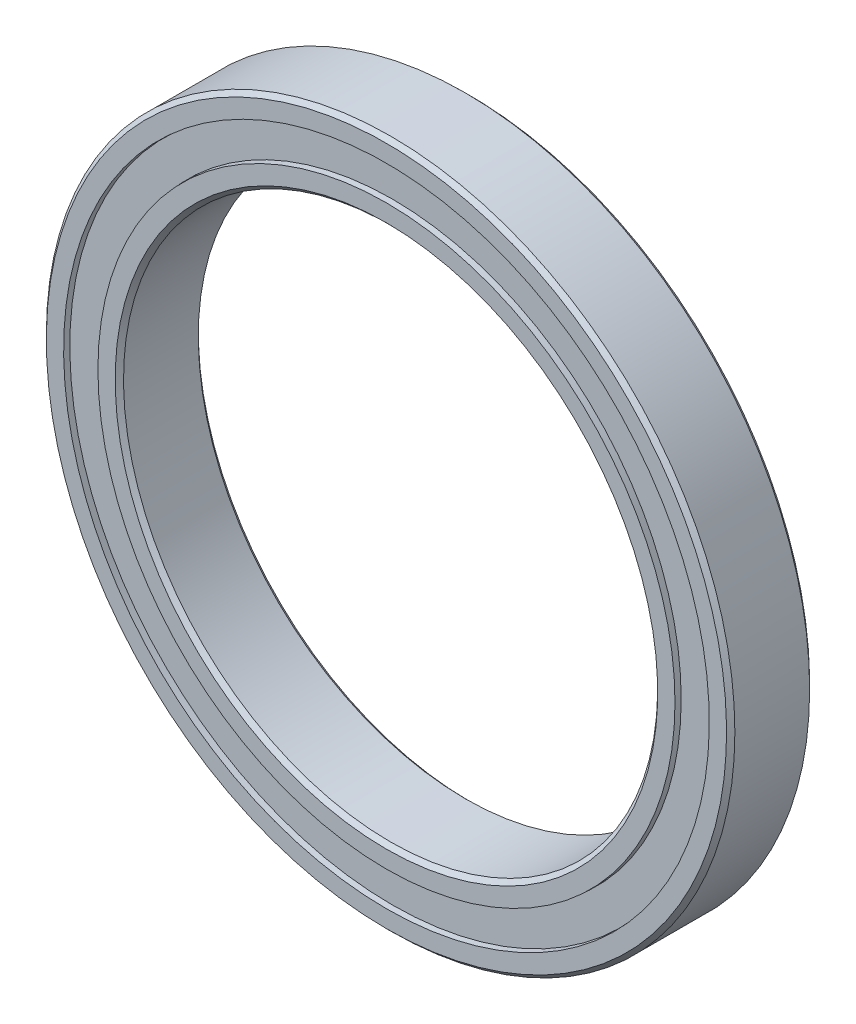
from build123d import *

# Parameters (mm, degrees)
SKETCH5_W         = 0.381
SKETCH5_H         = 2.838088888
CIRPATTERN1_COUNT = 21


with BuildPart() as part:
    # Sketch5 → Revolve1 (revolve)
    with BuildSketch(Plane(origin=(0, 0, 0), x_dir=(0, 0, -1), z_dir=(1, 0, 0)), mode=Mode.PRIVATE) as revolve1_sk:
        with BuildLine():
            Line((3.15, 29), (-3.15, 29))
            Line((-3.15, 29), (-3.5, 28.65))
            Line((-3.5, 28.65), (-3.5, 27.194444444))
            Line((-3.5, 27.194444444), (-1.555555556, 27.194444444))
            ThreePointArc((-1.555555556, 27.194444444), (0, 27.872774797), (1.555555556, 27.194444444))
            Line((1.555555556, 27.194444444), (3.5, 27.194444444))
            Line((3.5, 27.194444444), (3.5, 28.65))
            Line((3.5, 28.65), (3.15, 29))
        make_face()
        with Locations((2.811387399, 25.75)):
            Rectangle(SKETCH5_W, SKETCH5_H)
        with Locations((-2.811387399, 25.75)):
            Rectangle(SKETCH5_W, SKETCH5_H)
    revolve(revolve1_sk.sketch.rotate(Axis((0, 0, 3.5), (0, 0, -1)), 180), axis=Axis((0, 0, 3.5), (0, 0, -1)))


with BuildPart() as body_2:
    # Sketch3 → Revolve3 (revolve)
    with BuildSketch(Plane(origin=(0, 0, 0), x_dir=(0, 0, -1), z_dir=(1, 0, 0)), mode=Mode.PRIVATE) as revolve3_sk:
        with BuildLine():
            Line((-3.5, 24.305555556), (-1.555555556, 24.305555556))
            ThreePointArc((-1.555555556, 24.305555556), (0, 23.627225203), (1.555555556, 24.305555556))
            Line((1.555555556, 24.305555556), (3.5, 24.305555556))
            Line((3.5, 24.305555556), (3.5, 22.85))
            Line((3.5, 22.85), (3.15, 22.5))
            Line((3.15, 22.5), (-3.15, 22.5))
            Line((-3.15, 22.5), (-3.5, 22.85))
            Line((-3.5, 22.85), (-3.5, 24.305555556))
        make_face()
    revolve(revolve3_sk.sketch.rotate(Axis((0, 0, 3.5), (0, 0, -1)), 180), axis=Axis((0, 0, 3.5), (0, 0, -1)))


with BuildPart() as body_3:
    # Sketch4 → Revolve4 (revolve)
    with BuildSketch(Plane(origin=(0, 0, 0), x_dir=(0, 0, -1), z_dir=(1, 0, 0))):
        with BuildLine():
            Line((-2.122774797, 25.75), (2.122774797, 25.75))
            ThreePointArc((2.122774797, 25.75), (0, 27.872774797), (-2.122774797, 25.75))
        make_face()
    revolve(axis=Axis((0, 25.75, 2.122774797), (0, 0, -1)))


with BuildPart() as cirpattern1_1:
    # CirPattern1: pattern copy
    add(body_3.part.rotate(Axis((0, 0, 0), (0, 0, 1)), 1 * 360 / CIRPATTERN1_COUNT))


with BuildPart() as cirpattern1_2:
    # CirPattern1: pattern copy
    add(body_3.part.rotate(Axis((0, 0, 0), (0, 0, 1)), 2 * 360 / CIRPATTERN1_COUNT))


with BuildPart() as cirpattern1_3:
    # CirPattern1: pattern copy
    add(body_3.part.rotate(Axis((0, 0, 0), (0, 0, 1)), 3 * 360 / CIRPATTERN1_COUNT))


with BuildPart() as cirpattern1_4:
    # CirPattern1: pattern copy
    add(body_3.part.rotate(Axis((0, 0, 0), (0, 0, 1)), 4 * 360 / CIRPATTERN1_COUNT))


with BuildPart() as cirpattern1_5:
    # CirPattern1: pattern copy
    add(body_3.part.rotate(Axis((0, 0, 0), (0, 0, 1)), 5 * 360 / CIRPATTERN1_COUNT))


with BuildPart() as cirpattern1_6:
    # CirPattern1: pattern copy
    add(body_3.part.rotate(Axis((0, 0, 0), (0, 0, 1)), 6 * 360 / CIRPATTERN1_COUNT))


with BuildPart() as cirpattern1_7:
    # CirPattern1: pattern copy
    add(body_3.part.rotate(Axis((0, 0, 0), (0, 0, 1)), 7 * 360 / CIRPATTERN1_COUNT))


with BuildPart() as cirpattern1_8:
    # CirPattern1: pattern copy
    add(body_3.part.rotate(Axis((0, 0, 0), (0, 0, 1)), 8 * 360 / CIRPATTERN1_COUNT))


with BuildPart() as cirpattern1_9:
    # CirPattern1: pattern copy
    add(body_3.part.rotate(Axis((0, 0, 0), (0, 0, 1)), 9 * 360 / CIRPATTERN1_COUNT))


with BuildPart() as cirpattern1_10:
    # CirPattern1: pattern copy
    add(body_3.part.rotate(Axis((0, 0, 0), (0, 0, 1)), 10 * 360 / CIRPATTERN1_COUNT))


with BuildPart() as cirpattern1_11:
    # CirPattern1: pattern copy
    add(body_3.part.rotate(Axis((0, 0, 0), (0, 0, 1)), 11 * 360 / CIRPATTERN1_COUNT))


with BuildPart() as cirpattern1_12:
    # CirPattern1: pattern copy
    add(body_3.part.rotate(Axis((0, 0, 0), (0, 0, 1)), 12 * 360 / CIRPATTERN1_COUNT))


with BuildPart() as cirpattern1_13:
    # CirPattern1: pattern copy
    add(body_3.part.rotate(Axis((0, 0, 0), (0, 0, 1)), 13 * 360 / CIRPATTERN1_COUNT))


with BuildPart() as cirpattern1_14:
    # CirPattern1: pattern copy
    add(body_3.part.rotate(Axis((0, 0, 0), (0, 0, 1)), 14 * 360 / CIRPATTERN1_COUNT))


with BuildPart() as cirpattern1_15:
    # CirPattern1: pattern copy
    add(body_3.part.rotate(Axis((0, 0, 0), (0, 0, 1)), 15 * 360 / CIRPATTERN1_COUNT))


with BuildPart() as cirpattern1_16:
    # CirPattern1: pattern copy
    add(body_3.part.rotate(Axis((0, 0, 0), (0, 0, 1)), 16 * 360 / CIRPATTERN1_COUNT))


with BuildPart() as cirpattern1_17:
    # CirPattern1: pattern copy
    add(body_3.part.rotate(Axis((0, 0, 0), (0, 0, 1)), 17 * 360 / CIRPATTERN1_COUNT))


with BuildPart() as cirpattern1_18:
    # CirPattern1: pattern copy
    add(body_3.part.rotate(Axis((0, 0, 0), (0, 0, 1)), 18 * 360 / CIRPATTERN1_COUNT))


with BuildPart() as cirpattern1_19:
    # CirPattern1: pattern copy
    add(body_3.part.rotate(Axis((0, 0, 0), (0, 0, 1)), 19 * 360 / CIRPATTERN1_COUNT))


with BuildPart() as cirpattern1_20:
    # CirPattern1: pattern copy
    add(body_3.part.rotate(Axis((0, 0, 0), (0, 0, 1)), 20 * 360 / CIRPATTERN1_COUNT))


solid = Compound([part.part, body_2.part, body_3.part, cirpattern1_1.part, cirpattern1_2.part, cirpattern1_3.part, cirpattern1_4.part, cirpattern1_5.part, cirpattern1_6.part, cirpattern1_7.part, cirpattern1_8.part, cirpattern1_9.part, cirpattern1_10.part, cirpattern1_11.part, cirpattern1_12.part, cirpattern1_13.part, cirpattern1_14.part, cirpattern1_15.part, cirpattern1_16.part, cirpattern1_17.part, cirpattern1_18.part, cirpattern1_19.part, cirpattern1_20.part])
